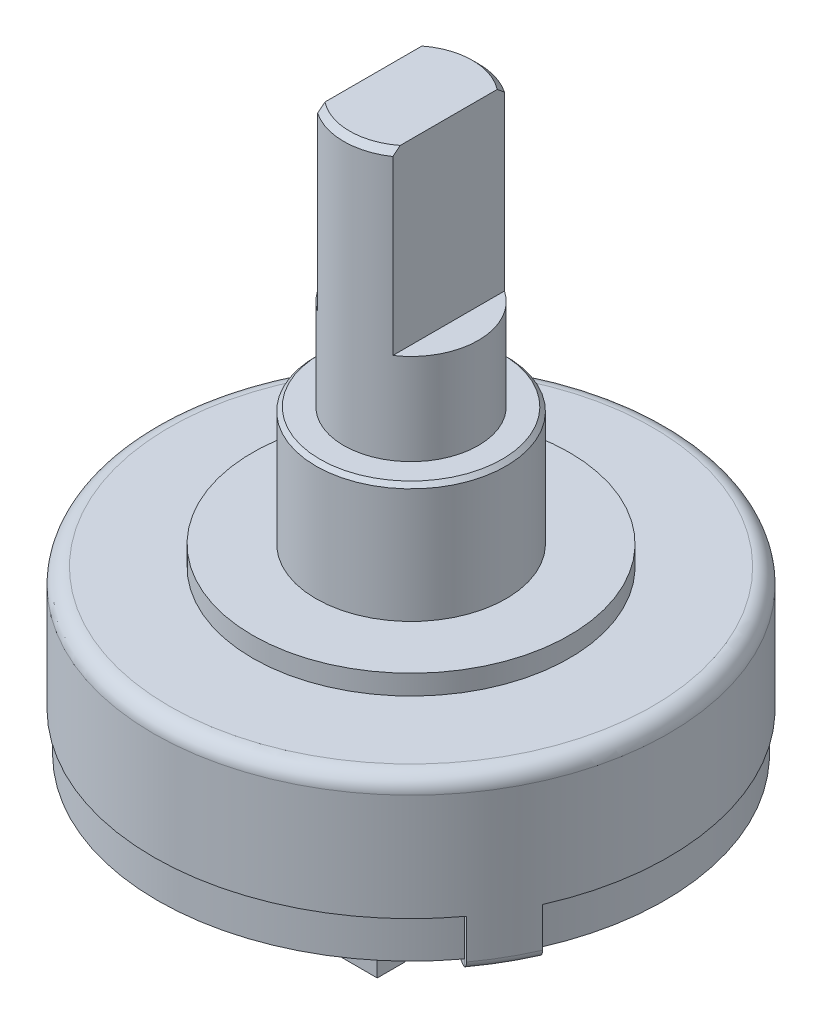
from build123d import *

# Parameters (mm, degrees)
SKETCH1_R            = 6.5
BOSS_EXTRUDE1_DEPTH  = 3.1
SKETCH2_R            = 4
BOSS_EXTRUDE2_DEPTH  = 0.5
SKETCH3_R            = 2.4
BOSS_EXTRUDE3_DEPTH  = 3
SKETCH4_R            = 1.7
BOSS_EXTRUDE4_DEPTH  = 6.8
CHAMFER1_SIZE        = 0.15
CUT_EXTRUDE1_DEPTH   = 4.5
SKETCH6_R            = 6.4
BOSS_EXTRUDE5_DEPTH  = 1
FILLET1_R            = 0.4
CHAMFER2_SIZE        = 0.1
BOSS_EXTRUDE6_START  = 1.2
BOSS_EXTRUDE6_DEPTH  = 1.2
SKETCH8_W            = 1.400599112
SKETCH8_H            = 0.2
BOSS_EXTRUDE7_DEPTH  = 1.2
SKETCH9_W            = 1.400599112
SKETCH9_H            = 0.2
BOSS_EXTRUDE8_DEPTH  = 1.2
SKETCH10_W           = 1.370501576
SKETCH10_H           = 0.2
BOSS_EXTRUDE9_DEPTH  = 1.2
FILLET2_R            = 0.5
FILLET3_R            = 0.2
SKETCH11_W           = 1.09784978
SKETCH11_H           = 0.766423431
SKETCH11_W_2         = 1.035707339
SKETCH11_H_2         = 0.70428099
SKETCH11_W_3         = 1.242848807
BOSS_EXTRUDE10_DEPTH = 2


with BuildPart() as part:
    # Sketch1 → Boss-Extrude1 (new body)
    with BuildSketch(Plane(origin=(0, 0, 0), x_dir=(1, 0, 0), z_dir=(0, 1, 0))):
        with Locations(Location((0, 0, 0), (0, 0, 90))):
            Circle(SKETCH1_R)
    extrude(amount=BOSS_EXTRUDE1_DEPTH)

    # Sketch2 → Boss-Extrude2 (add)
    with BuildSketch(Plane(origin=(0, 3.1, 0), x_dir=(1, 0, 0), z_dir=(0, 1, 0))):
        with Locations(Location((0, 0, 0), (0, 0, 270))):
            Circle(SKETCH2_R)
    extrude(amount=BOSS_EXTRUDE2_DEPTH)

    # Sketch3 → Boss-Extrude3 (add)
    with BuildSketch(Plane(origin=(0, 3.6, 0), x_dir=(-1, 0, 0), z_dir=(0, 1, 0))):
        with Locations(Location((0, 0, 0), (0, 0, 90))):
            Circle(SKETCH3_R)
    extrude(amount=BOSS_EXTRUDE3_DEPTH)

    # Sketch4 → Boss-Extrude4 (add)
    with BuildSketch(Plane(origin=(0, 6.6, 0), x_dir=(1, 0, 0), z_dir=(0, 1, 0))):
        with Locations(Location((0, 0, 0), (0, 0, 270))):
            Circle(SKETCH4_R)
    extrude(amount=BOSS_EXTRUDE4_DEPTH)

    # Chamfer1
    chamfer1_edges = [part.edges().sort_by_distance(p)[0] for p in [
        (0, 13.4, -1.7),
    ]]
    chamfer(chamfer1_edges, length=CHAMFER1_SIZE)

    # Sketch5 → Cut-Extrude1 (cut)
    with BuildSketch(Plane(origin=(0, 13.4, 0), x_dir=(1, 0, 0), z_dir=(0, 1, 0))):
        Polygon((0.95, 0), (0.95, 1.953547683), (2.291589772, 1.953547683), (2.291589772, -1.88704126), (0.95, -1.88704126), align=None)
        Polygon((-0.95, 0), (-0.95, 2.055691006), (-2.284431096, 2.055691006), (-2.21293077, -1.815540934), (-0.95, -1.815540934), align=None)
    extrude(amount=-CUT_EXTRUDE1_DEPTH, mode=Mode.SUBTRACT)

    # Sketch6 → Boss-Extrude5 (add)
    with BuildSketch(Plane.XZ):
        with Locations(Location((0, 0, 0), (0, 0, 90))):
            Circle(SKETCH6_R)
    extrude(amount=BOSS_EXTRUDE5_DEPTH)

    # Fillet1
    fillet1_edges = [part.edges().sort_by_distance(p)[0] for p in [
        (0, 3.1, 6.5),
    ]]
    fillet(fillet1_edges, radius=FILLET1_R)

    # Chamfer2
    chamfer2_edges = [part.edges().sort_by_distance(p)[0] for p in [
        (0, 6.6, -2.4),
    ]]
    chamfer(chamfer2_edges, length=CHAMFER2_SIZE)

    # Sketch7 → Boss-Extrude6 (add)
    with BuildSketch(Plane.XZ.offset(BOSS_EXTRUDE6_START)):
        with BuildLine():
            Line((5.151524141, 3.79760438), (5.242126256, 3.843190382))
            ThreePointArc((5.242126256, 3.843190382), (5.626855667, 3.253996819), (5.945638893, 2.626666738))
            Line((5.945638893, 2.626666738), (5.854255539, 2.586057247))
            Line((5.854255539, 2.586057247), (5.151524141, 3.79760438))
        make_face()
        with BuildLine():
            Line((-5.242126256, 3.843190382), (-5.151524141, 3.79760438))
            Line((-5.151524141, 3.79760438), (-5.854255539, 2.586057247))
            Line((-5.854255539, 2.586057247), (-5.945638893, 2.626666738))
            ThreePointArc((-5.945638893, 2.626666738), (-5.626855667, 3.253996819), (-5.242126256, 3.843190382))
        make_face()
        with BuildLine():
            Line((-0.7, -6.462197769), (-0.688624102, -6.362845028))
            Line((-0.688624102, -6.362845028), (0.681877282, -6.363571589))
            Line((0.681877282, -6.363571589), (0.7, -6.462197769))
            ThreePointArc((0.7, -6.462197769), (0, -6.5), (-0.7, -6.462197769))
        make_face()
    extrude(amount=-BOSS_EXTRUDE6_DEPTH)

    # Sketch8 → Boss-Extrude7 (add)
    with BuildSketch(Plane(origin=(5.50288984, 0, 3.191830814), x_dir=(-0.5017362869920535, 0, 0.8650206346182893), z_dir=(-0.8650206346182893, 0, -0.5017362869920535))):
        with Locations((0, -1.1)):
            Rectangle(SKETCH8_W, SKETCH8_H)
    extrude(amount=BOSS_EXTRUDE7_DEPTH)

    # Sketch9 → Boss-Extrude8 (add)
    with BuildSketch(Plane(origin=(-5.50288984, 0, 3.191830814), x_dir=(-0.5017362869920535, 0, -0.8650206346182893), z_dir=(0.8650206346182893, 0, -0.5017362869920535))):
        with Locations((0, -1.1)):
            Rectangle(SKETCH9_W, SKETCH9_H)
    extrude(amount=BOSS_EXTRUDE8_DEPTH)

    # Sketch10 → Boss-Extrude9 (add)
    with BuildSketch(Plane(origin=(-0.00337341, 0, -6.363208308), x_dir=(0.9999998594742814, 0, -0.0005301428274771333), z_dir=(0.0005301428274771333, 0, 0.9999998594742814))):
        with Locations((0, -1.1)):
            Rectangle(SKETCH10_W, SKETCH10_H)
    extrude(amount=BOSS_EXTRUDE9_DEPTH)

    # Fillet2
    fillet2_edges = [part.edges().sort_by_distance(p)[0] for p in [
        (4.113499379, -1.1, 3.195520836),
        (4.816230777, -1.1, 1.983973703),
        (-4.113499379, -1.1, 3.195520836),
        (-4.816230777, -1.1, 1.983973703),
        (0.682513454, -1.1, -5.163571758),
        (-0.68798793, -1.1, -5.162845196),
    ]]
    fillet(fillet2_edges, radius=FILLET2_R)

    # Fillet3
    fillet3_edges = [part.edges().sort_by_distance(p)[0] for p in [
        (5.626855667, -1.2, 3.253996819),
        (0, -1.2, -6.5),
        (-5.626855667, -1.2, 3.253996819),
    ]]
    fillet(fillet3_edges, radius=FILLET3_R)

    # Sketch11 → Boss-Extrude10 (add)
    with BuildSketch(Plane.XZ.offset(1)):
        with Locations((-0.051193187, 1.87960604)):
            Rectangle(SKETCH11_W, SKETCH11_H)
        with Locations((1.947721978, 2.967098746)):
            Rectangle(SKETCH11_W_2, SKETCH11_H_2)
        with Locations((-2.505819581, 2.967098746)):
            Rectangle(SKETCH11_W_3, SKETCH11_H_2)
    extrude(amount=BOSS_EXTRUDE10_DEPTH)


solid = part.part
